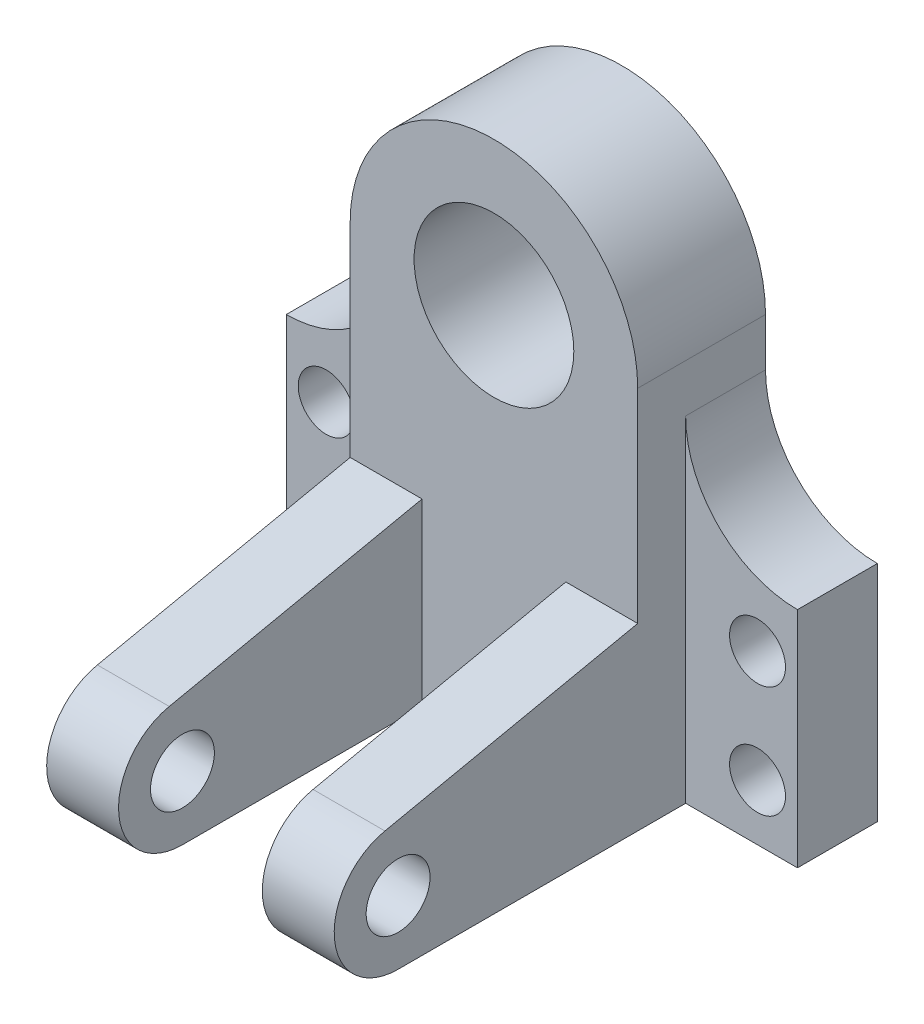
from build123d import *

# Parameters (mm, degrees)
SKETCH1_R           = 20
BOSS_EXTRUDE1_DEPTH = 32
BOSS_EXTRUDE2_DEPTH = 20
SKETCH4_R           = 8
BOSS_EXTRUDE3_DEPTH = 18
HOLE1_D             = 14
HOLE1_DEPTH         = 100


with BuildPart() as part:
    # Sketch1 → Boss-Extrude1 (new body)
    with BuildSketch(Plane.XY):
        with BuildLine():
            Line((-36, 96), (-36, 0))
            Line((-36, 0), (36, 0))
            Line((36, 0), (36, 96))
            ThreePointArc((36, 96), (0, 132), (-36, 96))
        make_face()
        with Locations((0, 96)):
            Circle(SKETCH1_R, mode=Mode.SUBTRACT)
    extrude(amount=BOSS_EXTRUDE1_DEPTH)

    # Sketch2 → Boss-Extrude2 (add)
    with BuildSketch(Plane.XY):
        with BuildLine():
            Line((36, 0), (64, 0))
            Line((64, 0), (64, 56))
            ThreePointArc((64, 56), (44.201010127, 64.201010127), (36, 84))
            Line((36, 84), (36, 0))
        make_face()
    boss_extrude2 = extrude(amount=BOSS_EXTRUDE2_DEPTH)

    # Mirror1: Boss-Extrude2 across plane
    add(boss_extrude2.mirror(Plane(origin=(0, 0, 0), x_dir=(0, 0, 1), z_dir=(1, 0, 0))))

    # Sketch4 → Boss-Extrude3 (add)
    with BuildSketch(Plane.ZY.offset(36)):
        with BuildLine():
            Line((32, 0), (92, 0))
            ThreePointArc((92, 0), (107.913745942, 14.340876714), (95.300358308, 31.65591374))
            Line((95.300358308, 31.65591374), (32, 45))
            Line((32, 45), (32, 0))
        make_face()
        with Locations(Location((92, 16, 0), (0, 0, 270))):
            Circle(SKETCH4_R, mode=Mode.SUBTRACT)
    boss_extrude3 = extrude(amount=-BOSS_EXTRUDE3_DEPTH)

    # Mirror2: Boss-Extrude3 across plane
    add(boss_extrude3.mirror(Plane(origin=(0, 0, 0), x_dir=(0, 0, 1), z_dir=(1, 0, 0))))

    # Hole1
    with Locations(Plane.XY.offset(20)):
        with Locations((54, 14), (54, 42)):
            hole1 = Hole(HOLE1_D / 2, depth=HOLE1_DEPTH)

    # Mirror3: Hole1 across plane
    add(hole1.mirror(Plane(origin=(0, 0, 0), x_dir=(0, 0, 1), z_dir=(1, 0, 0))), mode=Mode.SUBTRACT)


solid = part.part
